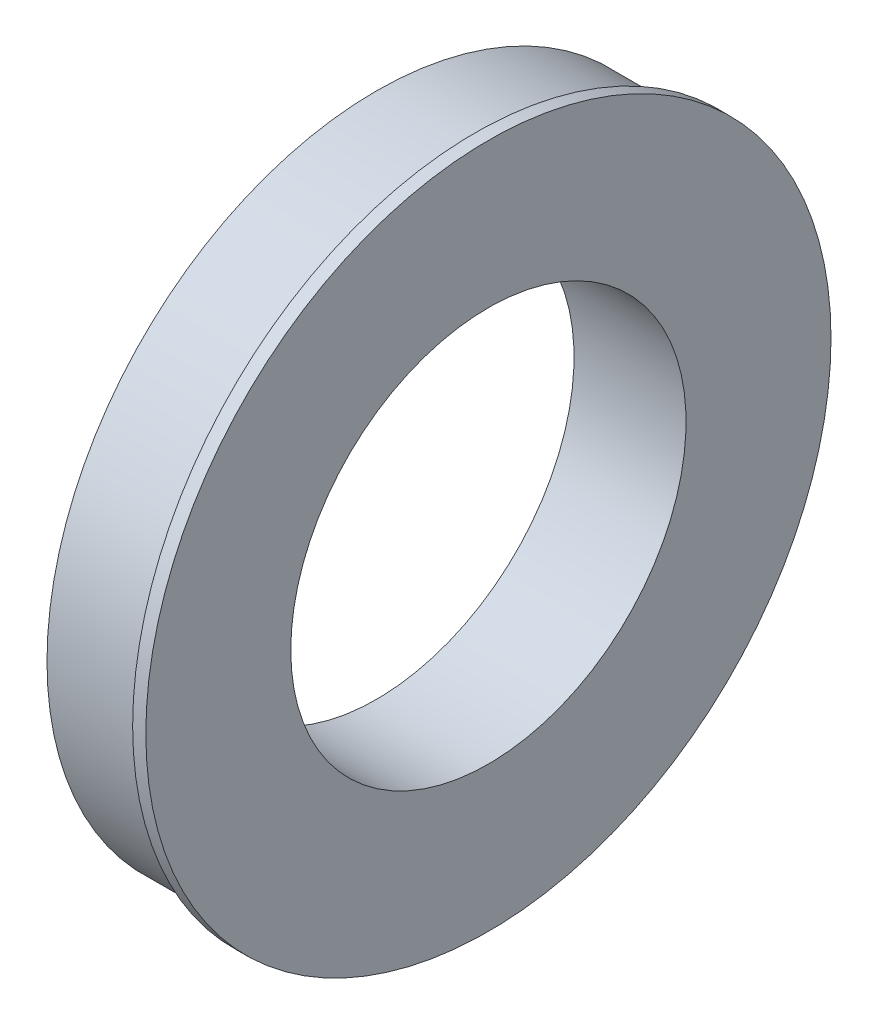
from build123d import *

# Parameters (mm, degrees)
SKETCH1_R           = 63.5
SKETCH1_R_2         = 38.1
BOSS_EXTRUDE1_DEPTH = 19.05
SKETCH2_R           = 66.04
SKETCH2_R_2         = 38.1
BOSS_EXTRUDE2_DEPTH = 2.54
SCALE1_SCALE        = 0.111317254


with BuildPart() as part:
    # Sketch1 → Boss-Extrude1 (new body)
    with BuildSketch(Plane(origin=(0, 0, 0), x_dir=(0, 0, -1), z_dir=(1, 0, 0))):
        with Locations(Location((0, 0, 0), (0, 0, 180))):
            Circle(SKETCH1_R)
        with Locations(Location((0, 0, 0), (0, 0, 180))):
            Circle(SKETCH1_R_2, mode=Mode.SUBTRACT)
    extrude(amount=BOSS_EXTRUDE1_DEPTH)

    # Sketch2 → Boss-Extrude2 (add)
    with BuildSketch(Plane(origin=(19.05, 0, 0), x_dir=(0, 0, -1), z_dir=(1, 0, 0))):
        Circle(SKETCH2_R)
        with Locations(Location((0, 0, 0), (0, 0, 180))):
            Circle(SKETCH2_R_2, mode=Mode.SUBTRACT)
    extrude(amount=BOSS_EXTRUDE2_DEPTH)


with BuildPart() as part_1:
    # Scale1: scaled about (10.935763547, 0, 0)
    add(part.part.scale(SCALE1_SCALE).moved(Location((9.718424377, 0, 0))))


solid = part_1.part
